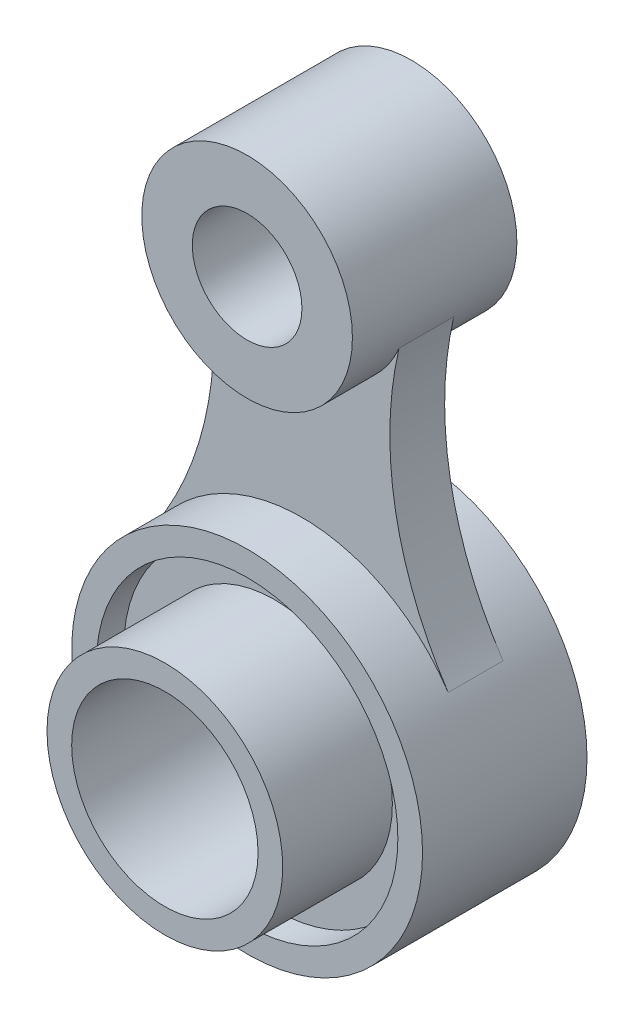
from build123d import *

# Parameters (mm, degrees)
BOSS_EXTRUDE1_DEPTH      = 5
BOSS_EXTRUDE1_DEPTH_BACK = 5
SKETCH1_R                = 27.5
SKETCH1_R_2              = 10
BOSS_EXTRUDE3_DEPTH      = 15
BOSS_EXTRUDE3_DEPTH_BACK = 15
SKETCH1_5_R              = 19.211681975
SKETCH1_5_R_2            = 10
SKETCH1_5_R_3            = 32
SKETCH1_5_R_4            = 27.5
BOSS_EXTRUDE4_DEPTH      = 30
BOSS_EXTRUDE4_DEPTH_BACK = 15
SKETCH1_6_R              = 21.5
SKETCH1_6_R_2            = 17
BOSS_EXTRUDE5_DEPTH      = 10
BOSS_EXTRUDE5_DEPTH_BACK = 15
SKETCH1_7_R              = 27.5
SKETCH1_7_R_2            = 21.5


with BuildPart() as part:
    # Sketch1 → Boss-Extrude1 (new, two sides: drawn at the far end of the back side and taken through both)
    with BuildSketch(Plane.XY.offset(-BOSS_EXTRUDE1_DEPTH_BACK)):
        with BuildLine():
            ThreePointArc((-26.678302647, -20.922495817), (0, -70.593606928), (26.678302647, -20.922495817))
            ThreePointArc((26.678302647, -20.922495817), (16.836772686, 4.320434327), (18.321243986, 31.373300703))
            ThreePointArc((18.321243986, 31.373300703), (0, 55.406393072), (-18.321243986, 31.373300703))
            ThreePointArc((-18.321243986, 31.373300703), (-16.836772686, 4.320434327), (-26.678302647, -20.922495817))
        make_face()
        with Locations((0, -38.593606928)):
            Circle(SKETCH1_R, mode=Mode.SUBTRACT)
        with Locations((0, 36.406393072)):
            Circle(SKETCH1_R_2, mode=Mode.SUBTRACT)
    extrude(amount=BOSS_EXTRUDE1_DEPTH + BOSS_EXTRUDE1_DEPTH_BACK)

    # Sketch1<5> → Boss-Extrude3 (add, two sides: drawn at the far end of the back side and taken through both)
    # profile 1 of 2: a face of its own
    with BuildSketch(Plane.XY.offset(-BOSS_EXTRUDE3_DEPTH_BACK)):
        with Locations((0, 36.406393072)):
            Circle(SKETCH1_5_R)
        with Locations((0, 36.406393072)):
            Circle(SKETCH1_5_R_2, mode=Mode.SUBTRACT)
    # profile 2 of 2: a face of its own
    with BuildSketch(Plane.XY.offset(-BOSS_EXTRUDE3_DEPTH_BACK)):
        with Locations((0, -38.593606928)):
            Circle(SKETCH1_5_R_3)
        with Locations((0, -38.593606928)):
            Circle(SKETCH1_5_R_4, mode=Mode.SUBTRACT)
    extrude(amount=BOSS_EXTRUDE3_DEPTH + BOSS_EXTRUDE3_DEPTH_BACK)



with BuildPart() as body_2:
    # Sketch1<6> → Boss-Extrude4 (new, two sides: drawn at the far end of the back side and taken through both)
    with BuildSketch(Plane.XY.offset(-BOSS_EXTRUDE4_DEPTH_BACK)):
        with Locations((0, -38.593606928)):
            Circle(SKETCH1_6_R)
        with Locations((0, -38.593606928)):
            Circle(SKETCH1_6_R_2, mode=Mode.SUBTRACT)
    extrude(amount=BOSS_EXTRUDE4_DEPTH + BOSS_EXTRUDE4_DEPTH_BACK)


with BuildPart() as part_1:
    add(part.part)

    add(body_2.part)  # Boss-Extrude5 merges body 2
    # Sketch1<7> → Boss-Extrude5 (add, two sides: drawn at the far end of the back side and taken through both)
    with BuildSketch(Plane.XY.offset(-BOSS_EXTRUDE5_DEPTH_BACK)):
        with Locations((0, -38.593606928)):
            Circle(SKETCH1_7_R)
        with Locations((0, -38.593606928)):
            Circle(SKETCH1_7_R_2, mode=Mode.SUBTRACT)
    extrude(amount=BOSS_EXTRUDE5_DEPTH + BOSS_EXTRUDE5_DEPTH_BACK)


solid = part_1.part
